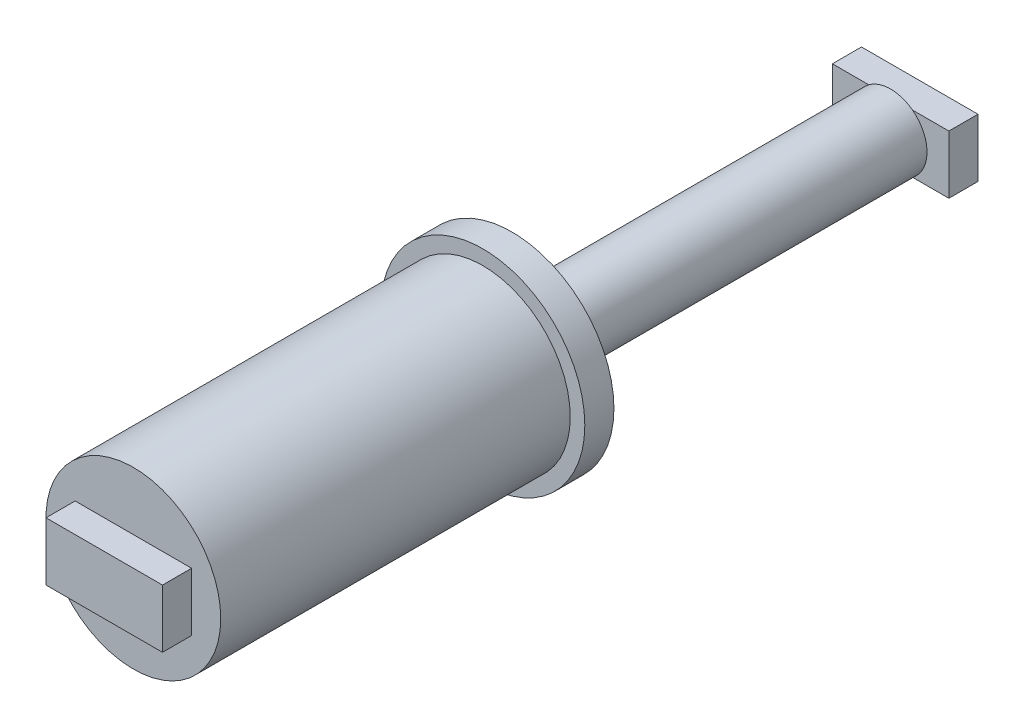
from build123d import *

# Parameters (mm, degrees)
SKETCH1_R           = 12.5
BOSS_EXTRUDE1_DEPTH = 130
SKETCH2_R           = 35
BOSS_EXTRUDE2_DEPTH = 10
SKETCH3_R           = 30
BOSS_EXTRUDE3_DEPTH = 120
SKETCH4_W           = 40
SKETCH4_H           = 20
BOSS_EXTRUDE4_DEPTH = 10
SCHIZZO1_W          = 40
SCHIZZO1_H          = 20
BOSS_EXTRUDE5_DEPTH = 10


with BuildPart() as part:
    # Sketch1 → Boss-Extrude1 (new body)
    with BuildSketch(Plane.XY):
        Circle(SKETCH1_R)
    extrude(amount=BOSS_EXTRUDE1_DEPTH)

    # Sketch2 → Boss-Extrude2 (add)
    with BuildSketch(Plane.XY.offset(130)):
        Circle(SKETCH2_R)
    extrude(amount=BOSS_EXTRUDE2_DEPTH)

    # Sketch3 → Boss-Extrude3 (add)
    with BuildSketch(Plane.XY.offset(140)):
        Circle(SKETCH3_R)
    extrude(amount=BOSS_EXTRUDE3_DEPTH)

    # Sketch4 → Boss-Extrude4 (add)
    with BuildSketch(Plane(origin=(0, 0, 0), x_dir=(-1, 0, 0), z_dir=(0, 0, -1))):
        Rectangle(SKETCH4_W, SKETCH4_H)
    extrude(amount=BOSS_EXTRUDE4_DEPTH)

    # Schizzo1 → Boss-Extrude5 (add)
    with BuildSketch(Plane.XY.offset(260)):
        Rectangle(SCHIZZO1_W, SCHIZZO1_H)
    extrude(amount=BOSS_EXTRUDE5_DEPTH)


solid = part.part
